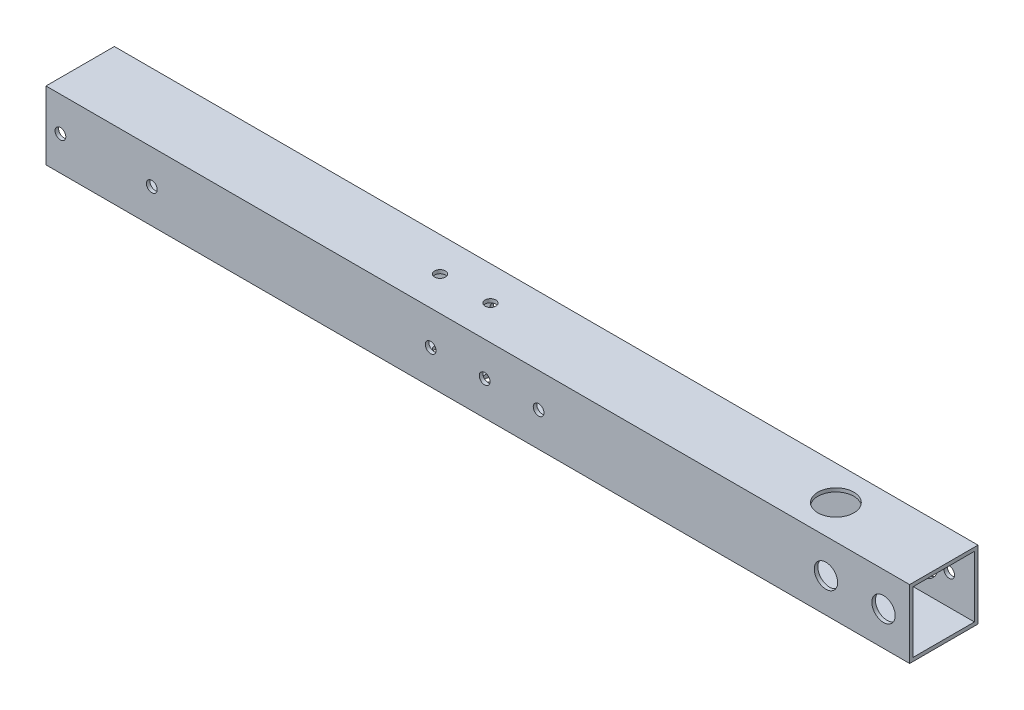
from build123d import *

# Parameters (mm, degrees)
SKETCH1_W           = 19
SKETCH1_H           = 19
SKETCH1_W_2         = 17
SKETCH1_H_2         = 17
BOSS_EXTRUDE1_DEPTH = 240
SKETCH3_R           = 1.5
CUT_EXTRUDE1_DEPTH  = 241.938270103
SKETCH7_R           = 1.5
CUT_EXTRUDE5_DEPTH  = 241.938270103
SKETCH9_R           = 5
CUT_EXTRUDE6_DEPTH  = 10
SKETCH10_R          = 3.25
CUT_EXTRUDE7_DEPTH  = 10
SKETCH11_R          = 5
SKETCH11_R_2        = 1.5
CUT_EXTRUDE8_DEPTH  = 10


with BuildPart() as part:
    # Sketch1 → Boss-Extrude1 (new body)
    with BuildSketch(Plane(origin=(0, 0, 0), x_dir=(0, 0, -1), z_dir=(1, 0, 0))):
        Rectangle(SKETCH1_W, SKETCH1_H)
        Rectangle(SKETCH1_W_2, SKETCH1_H_2, mode=Mode.SUBTRACT)
    extrude(amount=BOSS_EXTRUDE1_DEPTH)

    # Sketch3 → Cut-Extrude1 (cut, through all)
    with BuildSketch(Plane.XY.offset(9.5)):
        with Locations((4, 0)):
            Circle(SKETCH3_R)
        with Locations((29.4, 0)):
            Circle(SKETCH3_R)
        with Locations((106.9, 0)):
            Circle(SKETCH3_R)
        with Locations((121.9, 0)):
            Circle(SKETCH3_R)
        with Locations((136.9, 0)):
            Circle(SKETCH3_R)
    extrude(amount=-CUT_EXTRUDE1_DEPTH, mode=Mode.SUBTRACT)

    # Sketch7 → Cut-Extrude5 (cut, through all)
    with BuildSketch(Plane(origin=(0, 9.5, 0), x_dir=(1, 0, 0), z_dir=(0, 1, 0))):
        with Locations(Location((100, 0, 0), (0, 0, 270))):
            Circle(SKETCH7_R)
        with Locations(Location((114, 0, 0), (0, 0, 270))):
            Circle(SKETCH7_R)
    extrude(amount=-CUT_EXTRUDE5_DEPTH, mode=Mode.SUBTRACT)

    # Sketch9 → Cut-Extrude6 (cut)
    with BuildSketch(Plane(origin=(0, 9.5, 0), x_dir=(1, 0, 0), z_dir=(0, 1, 0))):
        with Locations(Location((210, 0, 0), (0, 0, 270))):
            Circle(SKETCH9_R)
    extrude(amount=-CUT_EXTRUDE6_DEPTH, mode=Mode.SUBTRACT)

    # Sketch10 → Cut-Extrude7 (cut)
    with BuildSketch(Plane.XY.offset(9.5)):
        with Locations((232.75, 0)):
            Circle(SKETCH10_R)
        with Locations((216.75, 0)):
            Circle(SKETCH10_R)
    extrude(amount=-CUT_EXTRUDE7_DEPTH, mode=Mode.SUBTRACT)

    # Sketch11 → Cut-Extrude8 (cut)
    with BuildSketch(Plane(origin=(0, 0, -9.5), x_dir=(-1, 0, 0), z_dir=(0, 0, -1))):
        with Locations((-225, 0)):
            Circle(SKETCH11_R)
        with Locations((-217, 0)):
            Circle(SKETCH11_R_2)
        with Locations((-233, 0)):
            Circle(SKETCH11_R_2)
    extrude(amount=-CUT_EXTRUDE8_DEPTH, mode=Mode.SUBTRACT)


solid = part.part
